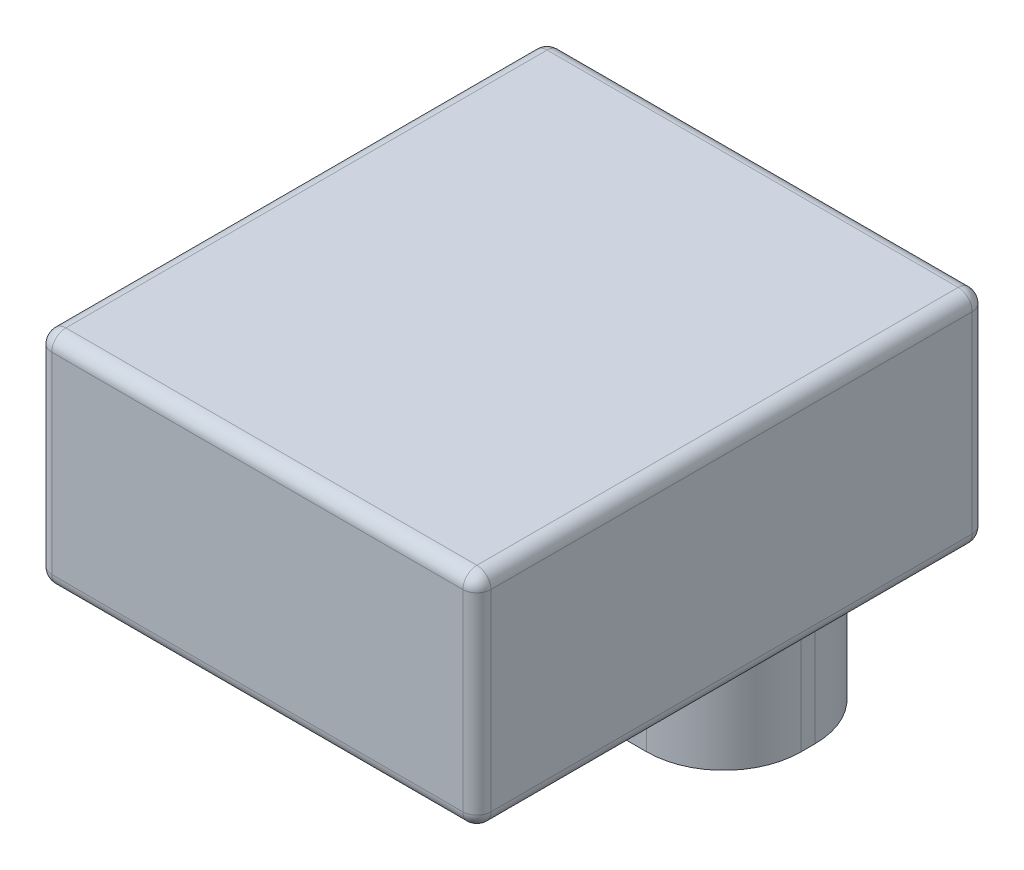
from build123d import *

# Parameters (mm, degrees)
SKETCH1_W           = 62.6
SKETCH1_H           = 72.6
BOSS_EXTRUDE1_DEPTH = 24.14
SKETCH2_W           = 50
SKETCH2_H           = 24
BOSS_EXTRUDE2_DEPTH = 19
SKETCH3_W           = 62.6
SKETCH3_H           = 72.6
BOSS_EXTRUDE3_DEPTH = 7.3
FILLET1_R           = 2
FILLET2_R           = 11


with BuildPart() as part:
    # Sketch1 → Boss-Extrude1 (new body)
    with BuildSketch(Plane(origin=(0, 0, 0), x_dir=(1, 0, 0), z_dir=(0, 1, 0))):
        Rectangle(SKETCH1_W, SKETCH1_H)
    extrude(amount=BOSS_EXTRUDE1_DEPTH)

    # Sketch2 → Boss-Extrude2 (add)
    with BuildSketch(Plane.XZ):
        with Locations((0, -17.2)):
            Rectangle(SKETCH2_W, SKETCH2_H)
    extrude(amount=BOSS_EXTRUDE2_DEPTH)

    # Sketch3 → Boss-Extrude3 (add)
    with BuildSketch(Plane(origin=(0, 24.14, 0), x_dir=(1, 0, 0), z_dir=(0, 1, 0))):
        Rectangle(SKETCH3_W, SKETCH3_H)
    extrude(amount=BOSS_EXTRUDE3_DEPTH)

    # Fillet1
    fillet1_edges = [part.edges().sort_by_distance(p)[0] for p in [
        (0, 31.44, 36.3),
        (31.3, 31.44, 0),
        (0, 31.44, -36.3),
        (-31.3, 31.44, 0),
        (0, 0, 36.3),
        (-31.3, 0, 0),
        (0, 0, -36.3),
        (31.3, 0, 0),
        (31.3, 15.72, 36.3),
        (-31.3, 15.72, 36.3),
        (-31.3, 15.72, -36.3),
        (31.3, 15.72, -36.3),
    ]]
    fillet(fillet1_edges, radius=FILLET1_R)

    # Fillet2
    fillet2_edges = [part.edges().sort_by_distance(p)[0] for p in [
        (-25, -9.5, -5.2),
        (-25, -9.5, -29.2),
        (25, -9.5, -29.2),
        (25, -9.5, -5.2),
    ]]
    fillet(fillet2_edges, radius=FILLET2_R)


solid = part.part
